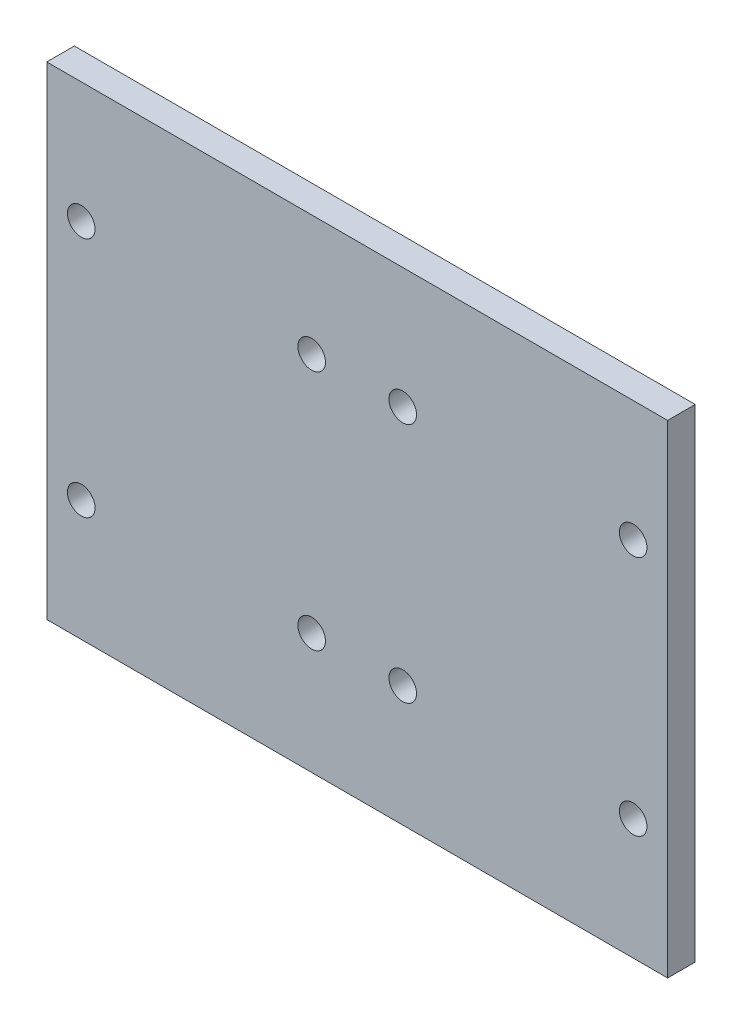
from build123d import *

# Parameters (mm, degrees)
SKETCH1_W           = 90
SKETCH1_H           = 70
SKETCH1_R           = 2
BOSS_EXTRUDE1_DEPTH = 4


with BuildPart() as part:
    # Sketch1 → Boss-Extrude1 (new body)
    with BuildSketch(Plane.XY):
        Rectangle(SKETCH1_W, SKETCH1_H)
        with Locations((-6.6, 17.5)):
            Circle(SKETCH1_R, mode=Mode.SUBTRACT)
        with Locations((6.6, 17.5)):
            Circle(SKETCH1_R, mode=Mode.SUBTRACT)
        with Locations((-6.6, -17.5)):
            Circle(SKETCH1_R, mode=Mode.SUBTRACT)
        with Locations((-40, 17.5)):
            Circle(SKETCH1_R, mode=Mode.SUBTRACT)
        with Locations((-40, -17.5)):
            Circle(SKETCH1_R, mode=Mode.SUBTRACT)
        with Locations((40, 17.5)):
            Circle(SKETCH1_R, mode=Mode.SUBTRACT)
        with Locations((6.6, -17.5)):
            Circle(SKETCH1_R, mode=Mode.SUBTRACT)
        with Locations((40, -17.5)):
            Circle(SKETCH1_R, mode=Mode.SUBTRACT)
    extrude(amount=BOSS_EXTRUDE1_DEPTH)


solid = part.part
